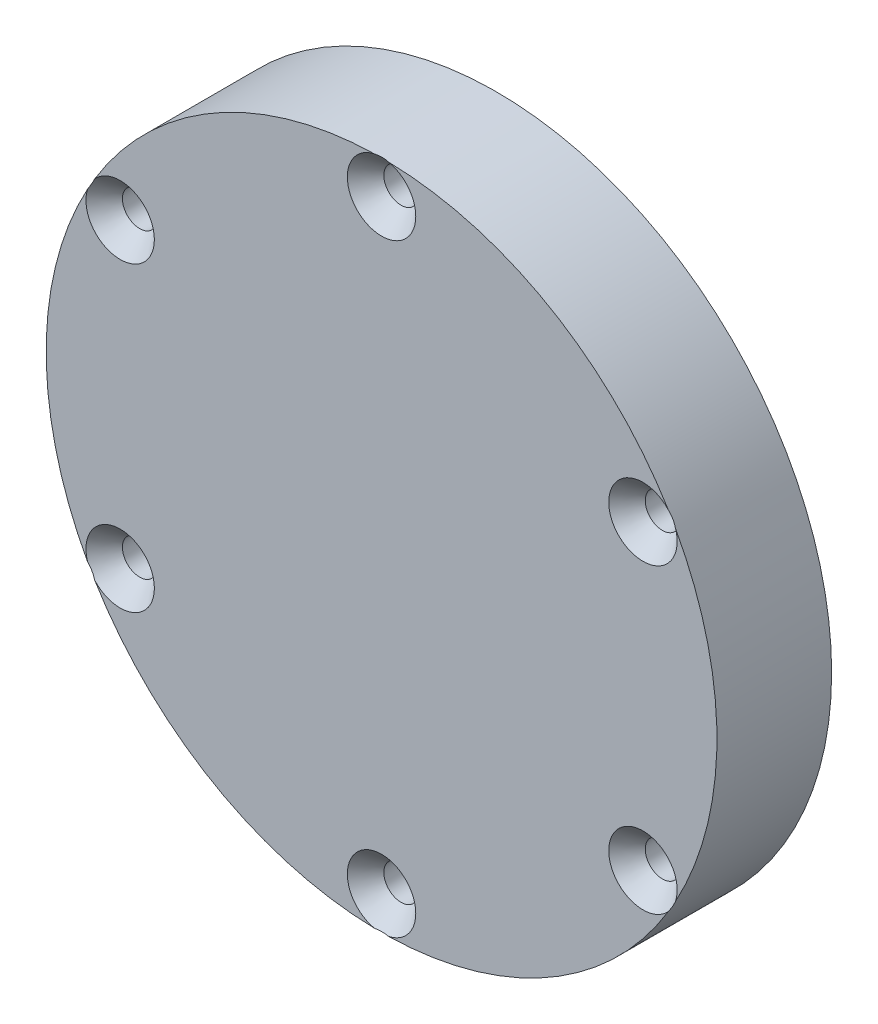
from build123d import *

# Parameters (mm, degrees)
SKETCH1_R                                         = 31.75
BOSS_EXTRUDE1_DEPTH                               = 10.8585
CSK_FOR_4_FLAT_HEAD_SOCKET_CAP_SCREW1_D           = 3.2639
CSK_FOR_4_FLAT_HEAD_SOCKET_CAP_SCREW1_CSINK_D     = 6.477
CSK_FOR_4_FLAT_HEAD_SOCKET_CAP_SCREW1_CSINK_ANGLE = 82
CIRPATTERN1_COUNT                                 = 6
CUT_EXTRUDE1_DEPTH                                = 8.47725
FILLET1_R                                         = 3.175
SKETCH5_R                                         = 4.7625
CUT_EXTRUDE2_DEPTH                                = 1.5875


with BuildPart() as part:
    # Sketch1 → Boss-Extrude1 (new body)
    with BuildSketch(Plane.XY):
        with Locations(Location((0, 0, 0), (0, 0, 180))):
            Circle(SKETCH1_R)
    extrude(amount=BOSS_EXTRUDE1_DEPTH)

    # CSK for #4 Flat Head Socket Cap Screw1 (through all)
    with Locations(Plane.XY.offset(10.8585)):
        with Locations((0, 28.575)):
            csk_for_4_flat_head_socket_cap_screw1 = CounterSinkHole(CSK_FOR_4_FLAT_HEAD_SOCKET_CAP_SCREW1_D / 2, CSK_FOR_4_FLAT_HEAD_SOCKET_CAP_SCREW1_CSINK_D / 2, counter_sink_angle=CSK_FOR_4_FLAT_HEAD_SOCKET_CAP_SCREW1_CSINK_ANGLE)

    # CirPattern1: CSK for #4 Flat Head Socket Cap Screw1 ×6 about axis
    cirpattern1_axis = Axis((0, 0, 0), (0, 0, 1))
    for i in range(1, CIRPATTERN1_COUNT):
        add(csk_for_4_flat_head_socket_cap_screw1.rotate(cirpattern1_axis, i * 360 / CIRPATTERN1_COUNT), mode=Mode.SUBTRACT)

    # Sketch4 → Cut-Extrude1 (cut)
    with BuildSketch(Plane(origin=(0, 0, 0), x_dir=(-1, 0, 0), z_dir=(0, 0, -1))):
        with BuildLine():
            ThreePointArc((-3.158514815, 29.198411956), (-14.684375, 25.434083577), (-23.707309096, 17.334560046))
            ThreePointArc((-23.707309096, 17.334560046), (-21.958550427, 12.677775), (-26.865823911, 11.86385191))
            ThreePointArc((-26.865823911, 11.86385191), (-29.36875, 0), (-26.865823911, -11.86385191))
            ThreePointArc((-26.865823911, -11.86385191), (-21.958550427, -12.677775), (-23.707309096, -17.334560046))
            ThreePointArc((-23.707309096, -17.334560046), (-14.684375, -25.434083577), (-3.158514815, -29.198411956))
            ThreePointArc((-3.158514815, -29.198411956), (0, -25.35555), (3.158514815, -29.198411956))
            ThreePointArc((3.158514815, -29.198411956), (14.684375, -25.434083577), (23.707309096, -17.334560046))
            ThreePointArc((23.707309096, -17.334560046), (21.958550427, -12.677775), (26.865823911, -11.86385191))
            ThreePointArc((26.865823911, -11.86385191), (29.36875, 0), (26.865823911, 11.86385191))
            ThreePointArc((26.865823911, 11.86385191), (21.958550427, 12.677775), (23.707309096, 17.334560046))
            ThreePointArc((23.707309096, 17.334560046), (14.684375, 25.434083577), (3.158514815, 29.198411956))
            ThreePointArc((3.158514815, 29.198411956), (0, 25.35555), (-3.158514815, 29.198411956))
        make_face()
    extrude(amount=-CUT_EXTRUDE1_DEPTH, mode=Mode.SUBTRACT)

    # Fillet1
    fillet1_edges = [part.edges().sort_by_distance(p)[0] for p in [
        (-3.158514815, 29.198411956, 4.238625),
        (-23.707309096, 17.334560046, 4.238625),
        (-26.865823911, 11.86385191, 4.238625),
        (-26.865823911, -11.86385191, 4.238625),
        (-23.707309096, -17.334560046, 4.238625),
        (-3.158514815, -29.198411956, 4.238625),
        (3.158514815, -29.198411956, 4.238625),
        (23.707309096, -17.334560046, 4.238625),
        (26.865823911, -11.86385191, 4.238625),
        (26.865823911, 11.86385191, 4.238625),
        (23.707309096, 17.334560046, 4.238625),
        (3.158514815, 29.198411956, 4.238625),
    ]]
    fillet(fillet1_edges, radius=FILLET1_R)

    # Sketch5 → Cut-Extrude2 (cut)
    with BuildSketch(Plane(origin=(0, 0, 8.47725), x_dir=(-1, 0, 0), z_dir=(0, 0, -1))):
        Circle(SKETCH5_R)
    extrude(amount=-CUT_EXTRUDE2_DEPTH, mode=Mode.SUBTRACT)


solid = part.part
